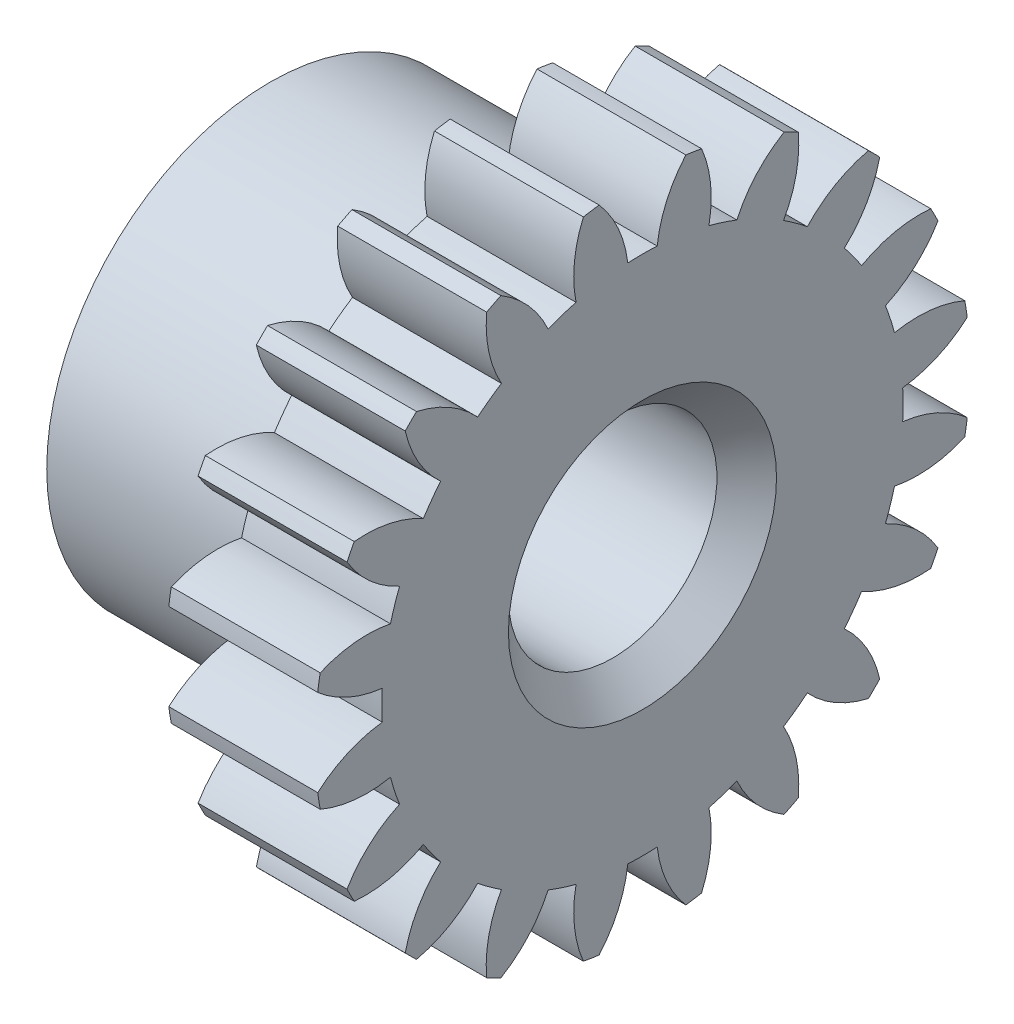
from build123d import *

# Parameters (mm, degrees)
BASPROSKE_W      = 10
BASPROSKE_H      = 22
TOOTHCUT_DEPTH   = 33.680269277
TEETHCUTS_COUNT  = 20
TEETHCUTS_ANGLE  = 342
HUBNEAONESKE_R   = 15
HUBNEARONE_DEPTH = 15.0000508
BORSKE_R         = 7
BORE_DEPTH       = 25.0000508
CHAMFER_1_SIZE   = 2


with BuildPart() as part:
    # BasProSke → Base-Revolve (revolve)
    with BuildSketch(Plane(origin=(0, 0, 0), x_dir=(1, 0, 0), z_dir=(0, 1, 0)), mode=Mode.PRIVATE) as base_revolve_sk:
        with Locations((5, 11)):
            Rectangle(BASPROSKE_W, BASPROSKE_H)
    revolve(base_revolve_sk.sketch.rotate(Axis((-10, 0, 0), (1, 0, 0)), 180), axis=Axis((-10, 0, 0), (1, 0, 0)))

    # TooCutSke → ToothCut (cut, through all)
    with BuildSketch(Plane(origin=(0, 0, 0), x_dir=(0, 0, -1), z_dir=(1, 0, 0))):
        with BuildLine():
            ThreePointArc((0.986171591, 17.471189616), (0, 17.499), (-0.986171591, 17.471189616))
            ThreePointArc((-0.986171591, 17.471189616), (-1.626916196, 19.798789858), (-2.932850173, 21.829260982))
            ThreePointArc((-2.932850173, 21.829260982), (0, 22.0254), (2.932850173, 21.829260982))
            ThreePointArc((2.932850173, 21.829260982), (1.626916196, 19.798789858), (0.986171591, 17.471189616))
        make_face()
    toothcut = extrude(amount=TOOTHCUT_DEPTH, mode=Mode.SUBTRACT)

    # TeethCuts: ToothCut ×20 about axis
    teethcuts_axis = Axis((-10, 0, 0), (1, 0, 0))
    for i in range(1, TEETHCUTS_COUNT):
        add(toothcut.rotate(teethcuts_axis, i * TEETHCUTS_ANGLE / (TEETHCUTS_COUNT - 1)), mode=Mode.SUBTRACT)

    # HubNeaOneSke → HubNearOne (add)
    with BuildSketch(Plane.ZY):
        with Locations(Location((0, 0, 0), (0, 0, 180))):
            Circle(HUBNEAONESKE_R)
    extrude(amount=HUBNEARONE_DEPTH)

    # BorSke → Bore (cut, symmetric)
    with BuildSketch(Plane(origin=(0, 0, 0), x_dir=(0, 0, -1), z_dir=(1, 0, 0))):
        with Locations(Location((0, 0, 0), (0, 0, 180))):
            Circle(BORSKE_R)
    extrude(amount=BORE_DEPTH, both=True, mode=Mode.SUBTRACT)

    # 倒角1
    chamfer_1_edges = [part.edges().sort_by_distance(p)[0] for p in [
        (-15.0000508, 0, -7),
        (10, 0, -7),
    ]]
    chamfer(chamfer_1_edges, length=CHAMFER_1_SIZE)


solid = part.part
